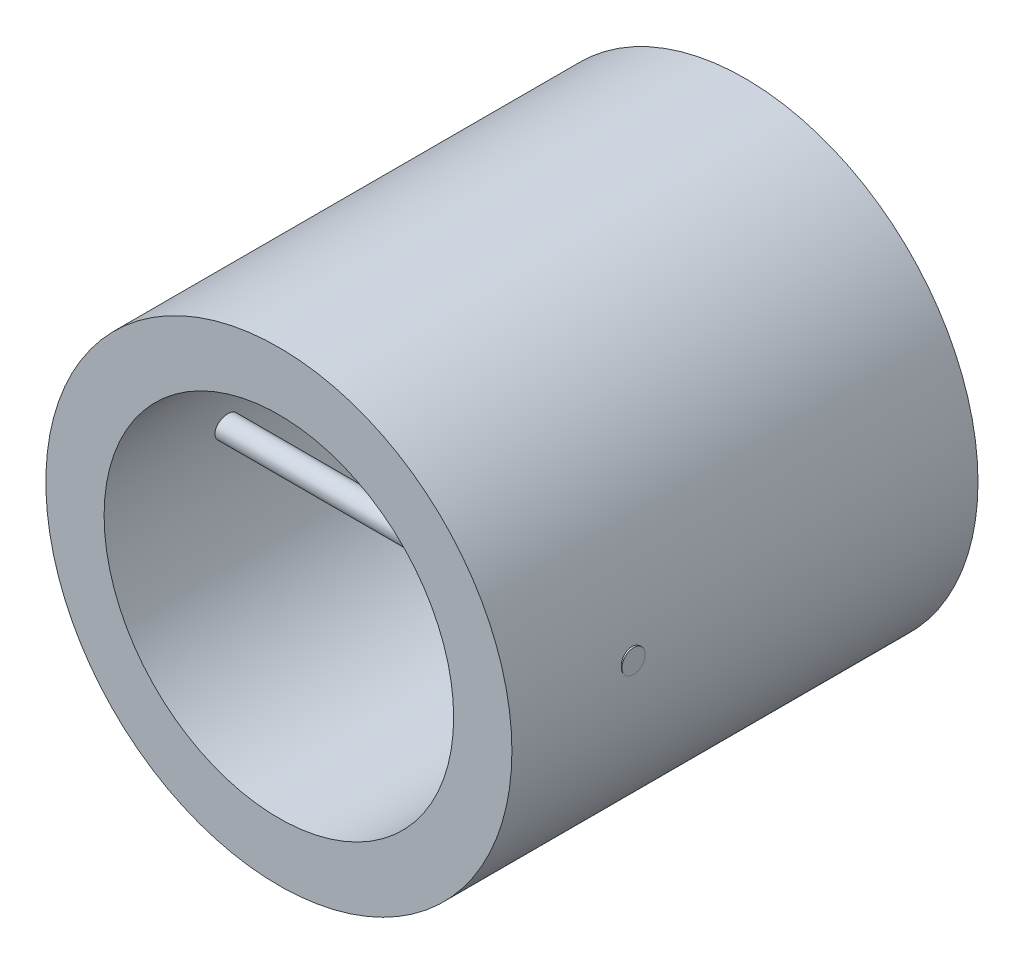
from build123d import *

# Parameters (mm, degrees)
BOSS_EXTRUDE1_DEPTH      = 20
BOSS_EXTRUDE1_DEPTH_BACK = 20
SKETCH1_R                = 20
SKETCH1_R_2              = 15
BOSS_EXTRUDE2_START      = -20
SKETCH2_R                = 1
BOSS_EXTRUDE2_DEPTH      = 40


with BuildPart() as part:
    # Sketch1 → Boss-Extrude1 (new, two sides: drawn at the far end of the back side and taken through both)
    with BuildSketch(Plane.XY.offset(-BOSS_EXTRUDE1_DEPTH_BACK)):
        Circle(SKETCH1_R)
        Circle(SKETCH1_R_2, mode=Mode.SUBTRACT)
    extrude(amount=BOSS_EXTRUDE1_DEPTH + BOSS_EXTRUDE1_DEPTH_BACK)

    # Sketch2 → Boss-Extrude2 (add)
    with BuildSketch(Plane(origin=(0, 0, 0), x_dir=(0, 0, -1), z_dir=(1, 0, 0)).offset(BOSS_EXTRUDE2_START)):
        with Locations(Location((-9.558885453, 1.461191935, 0), (0, 0, 180))):
            Circle(SKETCH2_R)
    extrude(amount=BOSS_EXTRUDE2_DEPTH)


solid = part.part
